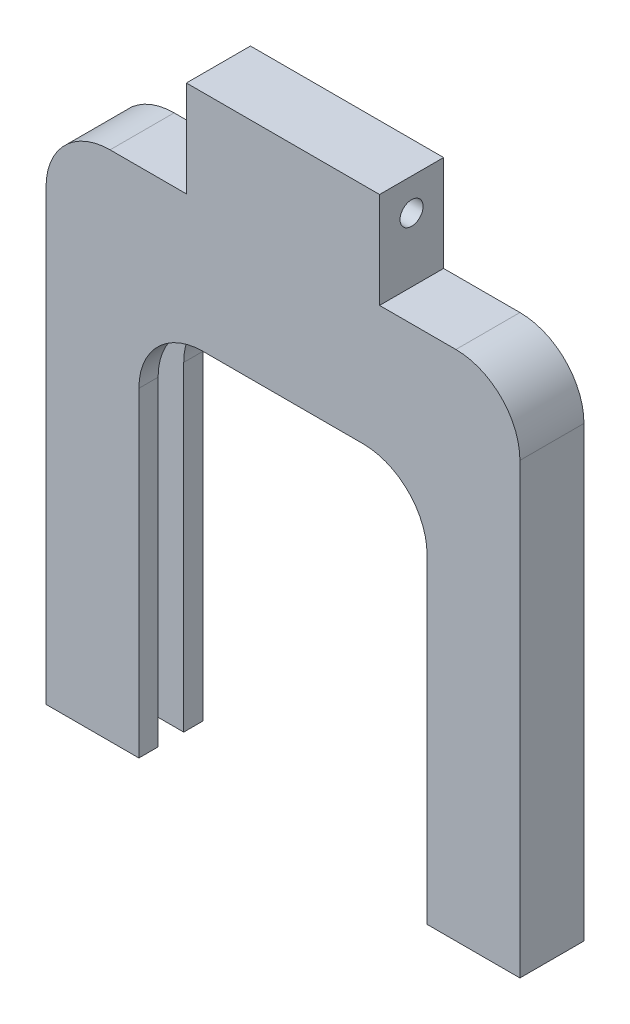
from build123d import *

# Parameters (mm, degrees)
CROQUIS1_W              = 74
CROQUIS1_H              = 80
SALIENTE_EXTRUIR1_DEPTH = 10
CROQUIS2_W              = 65.8
CROQUIS2_H              = 4
CORTAR_EXTRUIR1_DEPTH   = 60
CROQUIS3_W              = 45
CROQUIS3_H              = 60
CORTAR_EXTRUIR3_DEPTH   = 39
CROQUIS6_W              = 30.164087926
CROQUIS6_H              = 10
SALIENTE_EXTRUIR3_DEPTH = 15
REDONDEO1_R             = 10
REDONDEO2_R             = 10
CROQUIS7_R              = 1.8
CORTAR_EXTRUIR5_DEPTH   = 32
REDONDEO3_R             = 10
REDONDEO4_R             = 10
REDONDEO5_R             = 10
REDONDEO6_R             = 10


with BuildPart() as part:
    # Croquis1 → Saliente-Extruir1 (new body)
    with BuildSketch(Plane.XY):
        Rectangle(CROQUIS1_W, CROQUIS1_H)
    extrude(amount=SALIENTE_EXTRUIR1_DEPTH)

    # Croquis2 → Cortar-Extruir1 (cut)
    with BuildSketch(Plane.XZ.offset(40)):
        with Locations((0, 5)):
            Rectangle(CROQUIS2_W, CROQUIS2_H)
    extrude(amount=-CORTAR_EXTRUIR1_DEPTH, mode=Mode.SUBTRACT)

    # Croquis3 → Cortar-Extruir3 (cut)
    with BuildSketch(Plane.XY.offset(10)):
        with Locations((0, -10)):
            Rectangle(CROQUIS3_W, CROQUIS3_H)
    extrude(amount=-CORTAR_EXTRUIR3_DEPTH, mode=Mode.SUBTRACT)

    # Croquis6 → Saliente-Extruir3 (add)
    with BuildSketch(Plane(origin=(0, 40, 0), x_dir=(1, 0, 0), z_dir=(0, 1, 0))):
        with Locations((0, -5)):
            Rectangle(CROQUIS6_W, CROQUIS6_H)
    extrude(amount=SALIENTE_EXTRUIR3_DEPTH)

    # Redondeo1
    redondeo1_edges = [part.edges().sort_by_distance(p)[0] for p in [
        (-37, 40, 5),
    ]]
    fillet(redondeo1_edges, radius=REDONDEO1_R)

    # Redondeo2
    redondeo2_edges = [part.edges().sort_by_distance(p)[0] for p in [
        (37, 40, 5),
    ]]
    fillet(redondeo2_edges, radius=REDONDEO2_R)

    # Croquis7 → Cortar-Extruir5 (cut)
    with BuildSketch(Plane.ZY.offset(15.082043963)):
        with Locations((5, 50)):
            Circle(CROQUIS7_R)
    extrude(amount=-CORTAR_EXTRUIR5_DEPTH, mode=Mode.SUBTRACT)

    # Redondeo3
    redondeo3_edges = [part.edges().sort_by_distance(p)[0] for p in [
        (-22.5, 20, 8.5),
    ]]
    fillet(redondeo3_edges, radius=REDONDEO3_R)

    # Redondeo4
    redondeo4_edges = [part.edges().sort_by_distance(p)[0] for p in [
        (-22.5, 20, 1.5),
    ]]
    fillet(redondeo4_edges, radius=REDONDEO4_R)

    # Redondeo5
    redondeo5_edges = [part.edges().sort_by_distance(p)[0] for p in [
        (22.5, 20, 8.5),
    ]]
    fillet(redondeo5_edges, radius=REDONDEO5_R)

    # Redondeo6
    redondeo6_edges = [part.edges().sort_by_distance(p)[0] for p in [
        (22.5, 20, 1.5),
    ]]
    fillet(redondeo6_edges, radius=REDONDEO6_R)


solid = part.part
